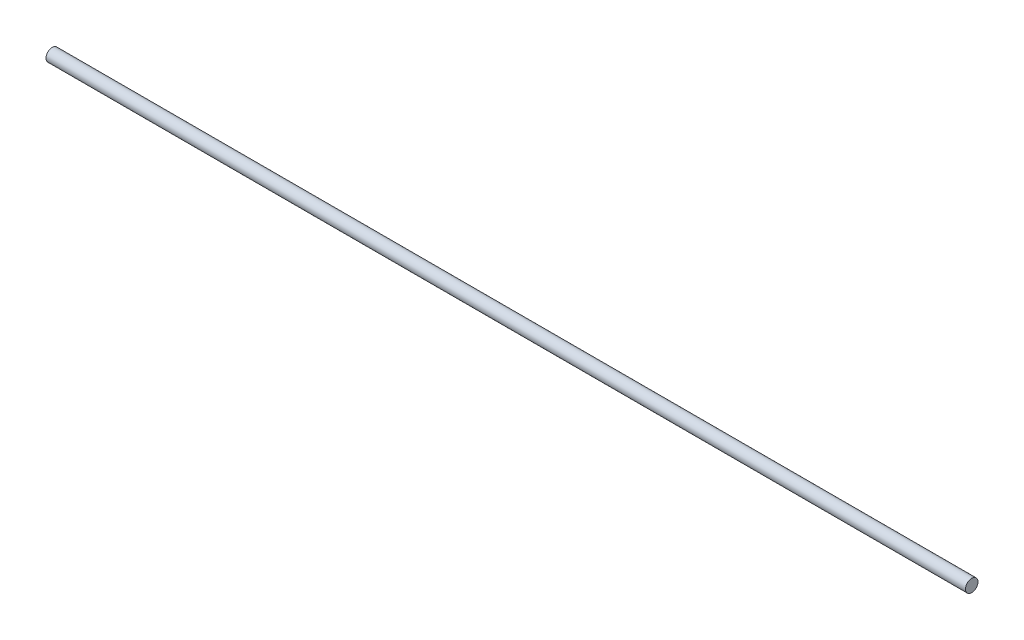
from build123d import *

# Parameters (mm, degrees)
SKETCH1_R           = 1.984375
BOSS_EXTRUDE1_DEPTH = 146.05


with BuildPart() as part:
    # Sketch1 → Boss-Extrude1 (new, symmetric)
    with BuildSketch(Plane(origin=(0, 0, 0), x_dir=(0, 0, -1), z_dir=(1, 0, 0))):
        Circle(SKETCH1_R)
    extrude(amount=BOSS_EXTRUDE1_DEPTH, both=True)


solid = part.part
